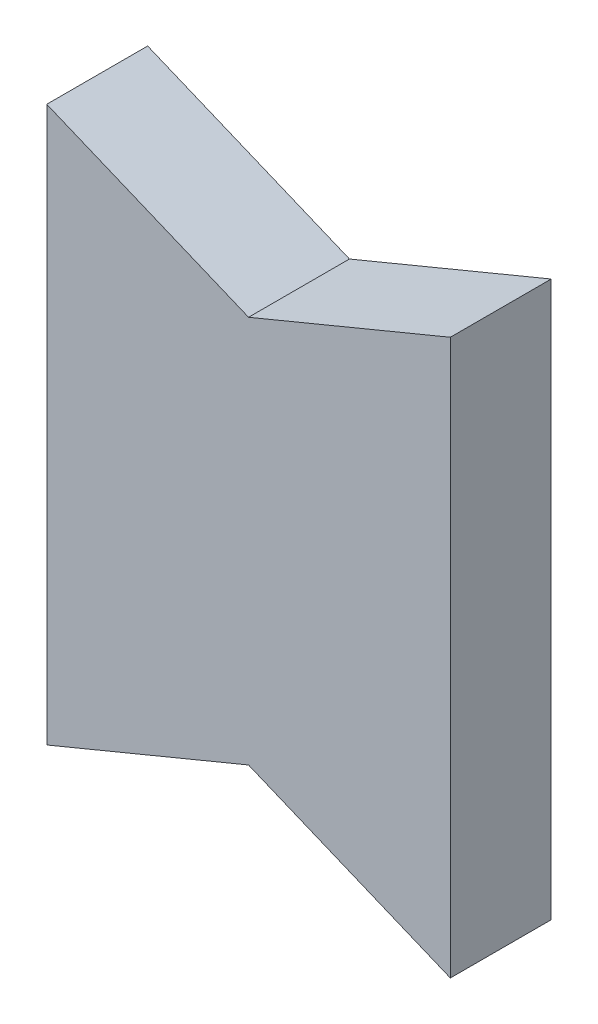
from build123d import *

# Parameters (mm, degrees)
AUFSATZ_LINEAR_AUSTRAGEN1_DEPTH = 2


with BuildPart() as part:
    # Skizze1 → Aufsatz-Linear austragen1 (new body)
    with BuildSketch(Plane(origin=(0, 0, 0), x_dir=(0, 1, 0), z_dir=(0, 0, 1))):
        Polygon((-5.5, 4), (5.5, 4), (3.843145751, 0), (-3.843145751, 0), align=None)
    aufsatz_linear_austragen1 = extrude(amount=AUFSATZ_LINEAR_AUSTRAGEN1_DEPTH)

    # Spiegeln1: Aufsatz-Linear austragen1 across plane
    add(aufsatz_linear_austragen1.mirror(Plane(origin=(0, 3.843145751, 2), x_dir=(0, 0, 1), z_dir=(-1, 0, 0))))


solid = part.part
